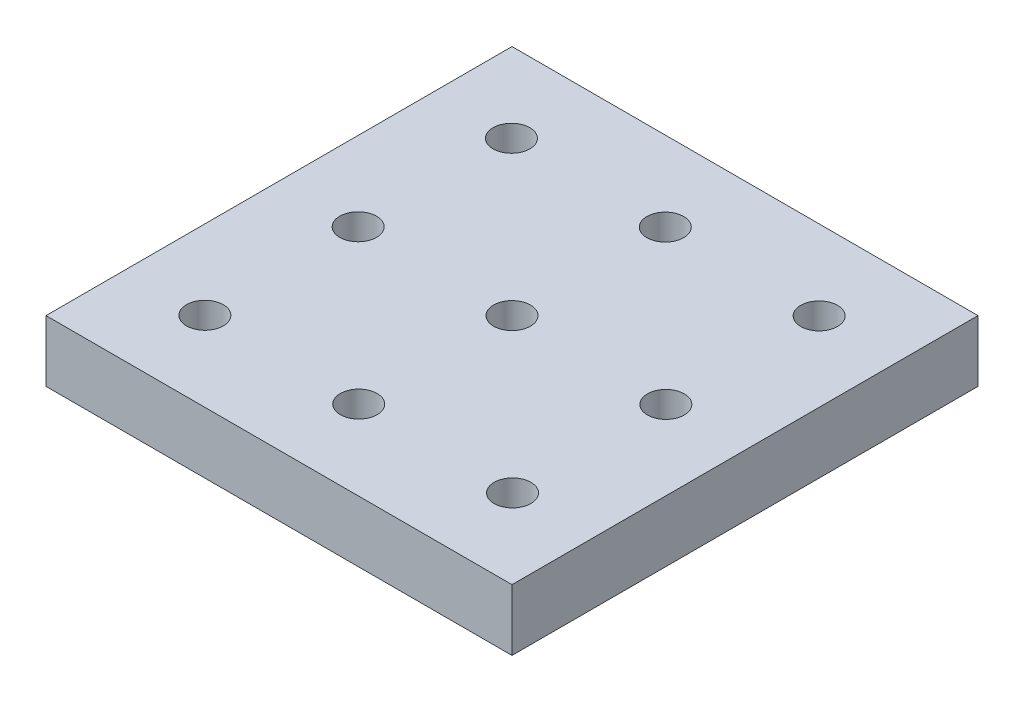
from build123d import *

# Parameters (mm, degrees)
SKETCH1_W           = 76
SKETCH1_H           = 76
SKETCH1_R           = 3
BOSS_EXTRUDE1_DEPTH = 10


with BuildPart() as part:
    # Sketch1 → Boss-Extrude1 (new body)
    with BuildSketch(Plane(origin=(0, 0, 0), x_dir=(1, 0, 0), z_dir=(0, 1, 0))):
        with Locations((-159.8596663, 81.710219679)):
            Rectangle(SKETCH1_W, SKETCH1_H)
        with Locations(Location((-159.8596663, 81.710219679, 0), (0, 0, 270))):
            Circle(SKETCH1_R, mode=Mode.SUBTRACT)
        with Locations(Location((-134.769453056, 81.710219679, 0), (0, 0, 270))):
            Circle(SKETCH1_R, mode=Mode.SUBTRACT)
        with Locations(Location((-184.949879544, 81.710219679, 0), (0, 0, 90))):
            Circle(SKETCH1_R, mode=Mode.SUBTRACT)
        with Locations(Location((-184.949879544, 106.710219679, 0), (0, 0, 90))):
            Circle(SKETCH1_R, mode=Mode.SUBTRACT)
        with Locations(Location((-159.8596663, 106.710219679, 0), (0, 0, 270))):
            Circle(SKETCH1_R, mode=Mode.SUBTRACT)
        with Locations(Location((-134.769453056, 106.710219679, 0), (0, 0, 270))):
            Circle(SKETCH1_R, mode=Mode.SUBTRACT)
        with Locations(Location((-134.769453056, 56.710219679, 0), (0, 0, 90))):
            Circle(SKETCH1_R, mode=Mode.SUBTRACT)
        with Locations(Location((-159.8596663, 56.710219679, 0), (0, 0, 90))):
            Circle(SKETCH1_R, mode=Mode.SUBTRACT)
        with Locations(Location((-184.949879544, 56.710219679, 0), (0, 0, 270))):
            Circle(SKETCH1_R, mode=Mode.SUBTRACT)
    extrude(amount=BOSS_EXTRUDE1_DEPTH)


solid = part.part
